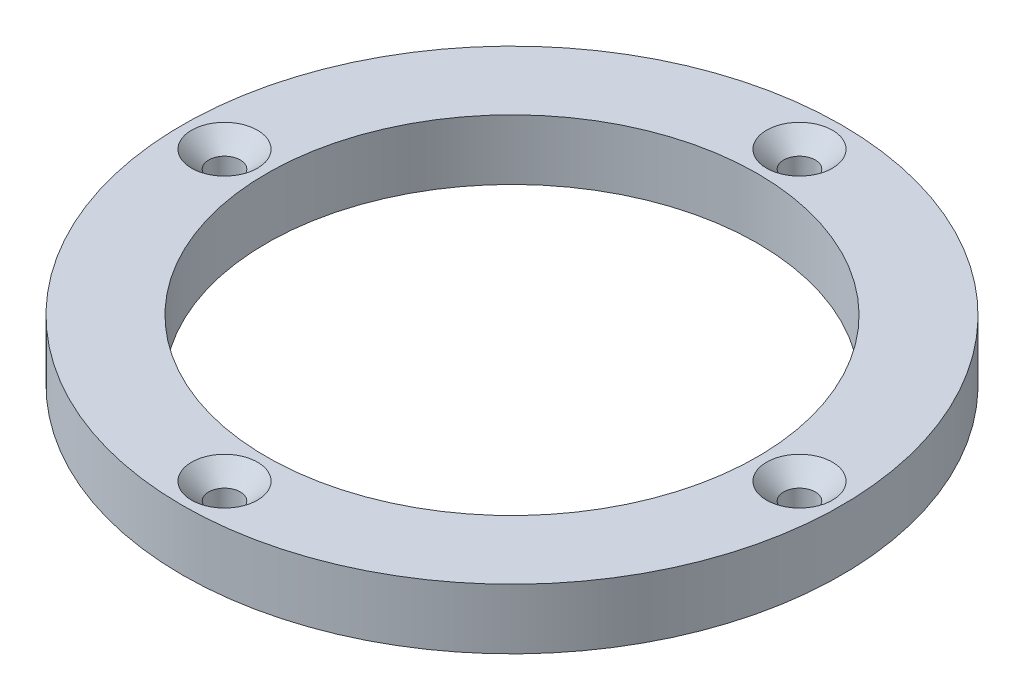
from build123d import *

# Parameters (mm, degrees)
SKETCH1_R                                       = 47
SKETCH1_R_2                                     = 35
BOSS_EXTRUDE1_DEPTH                             = 8.6
CSK_FOR_M4_FLAT_HEAD_MACHINE_SCREW1_D           = 4.5
CSK_FOR_M4_FLAT_HEAD_MACHINE_SCREW1_CSINK_D     = 9.4
CSK_FOR_M4_FLAT_HEAD_MACHINE_SCREW1_CSINK_ANGLE = 90


with BuildPart() as part:
    # Sketch1 → Boss-Extrude1 (new body)
    with BuildSketch(Plane(origin=(0, 0, 0), x_dir=(1, 0, 0), z_dir=(0, 1, 0))):
        Circle(SKETCH1_R)
        Circle(SKETCH1_R_2, mode=Mode.SUBTRACT)
    extrude(amount=BOSS_EXTRUDE1_DEPTH)

    # CSK for M4 Flat Head Machine Screw1 (through all)
    with Locations(Plane(origin=(0, 8.6, 0), x_dir=(1, 0, 0), z_dir=(0, 1, 0))):
        with Locations((0, 41), (0, -41), (-41, 0), (41, 0)):
            CounterSinkHole(CSK_FOR_M4_FLAT_HEAD_MACHINE_SCREW1_D / 2, CSK_FOR_M4_FLAT_HEAD_MACHINE_SCREW1_CSINK_D / 2, counter_sink_angle=CSK_FOR_M4_FLAT_HEAD_MACHINE_SCREW1_CSINK_ANGLE)


solid = part.part
